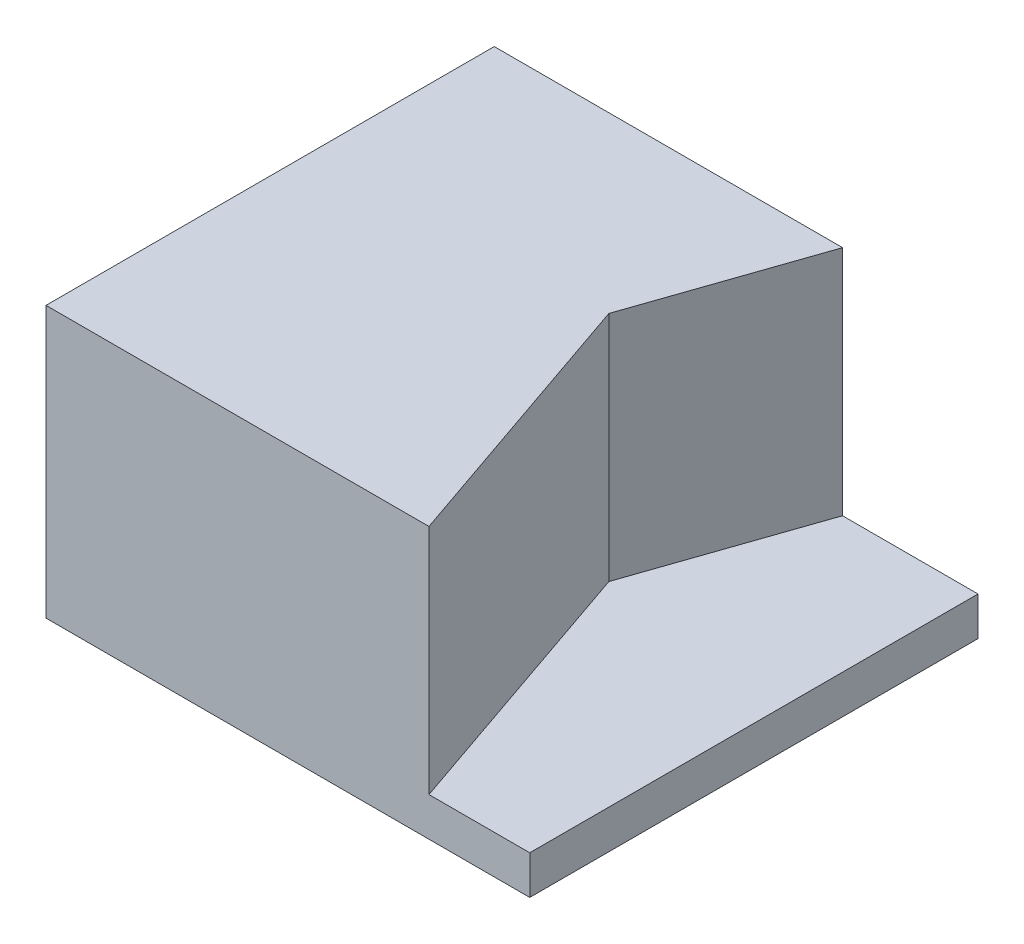
from build123d import *

# Parameters (mm, degrees)
BOSS_EXTRUDE1_DEPTH = 609.6
SKETCH2_W           = 1270
SKETCH2_H           = 1176.792419191
BOSS_EXTRUDE2_DEPTH = 101.6


with BuildPart() as part:
    # Sketch1 → Boss-Extrude1 (new body)
    with BuildSketch(Plane(origin=(0, 0, 0), x_dir=(1, 0, 0), z_dir=(0, 1, 0))):
        Polygon((0, 0), (157.119191341, 456.307264584), (-757.280808659, 456.307264584), (-757.280808659, -720.485154607), (248.082933696, -720.485154607), align=None)
    extrude(amount=BOSS_EXTRUDE1_DEPTH)

    # Sketch2 → Boss-Extrude2 (add)
    with BuildSketch(Plane.XZ):
        with Locations((-122.280808659, 132.088945011)):
            Rectangle(SKETCH2_W, SKETCH2_H)
    extrude(amount=BOSS_EXTRUDE2_DEPTH)


solid = part.part
